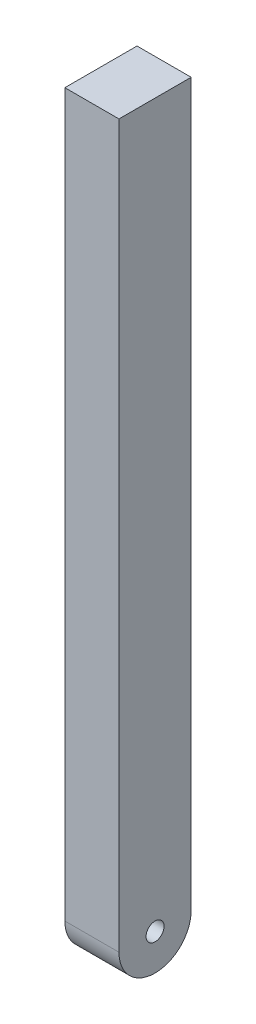
from build123d import *

# Parameters (mm, degrees)
ESQUISSE3_R = 2.5
BASE_DEPTH  = 15


with BuildPart() as part:
    # Esquisse3 → BASE (new body)
    with BuildSketch(Plane(origin=(0, 0, 0), x_dir=(0, 0, -1), z_dir=(1, 0, 0))):
        with BuildLine():
            Line((10, 100), (-10, 100))
            Line((-10, 100), (-10, -100))
            ThreePointArc((-10, -100), (0, -110), (10, -100))
            Line((10, -100), (10, 100))
        make_face()
        with Locations((0, -100)):
            Circle(ESQUISSE3_R, mode=Mode.SUBTRACT)
    extrude(amount=BASE_DEPTH)


solid = part.part
